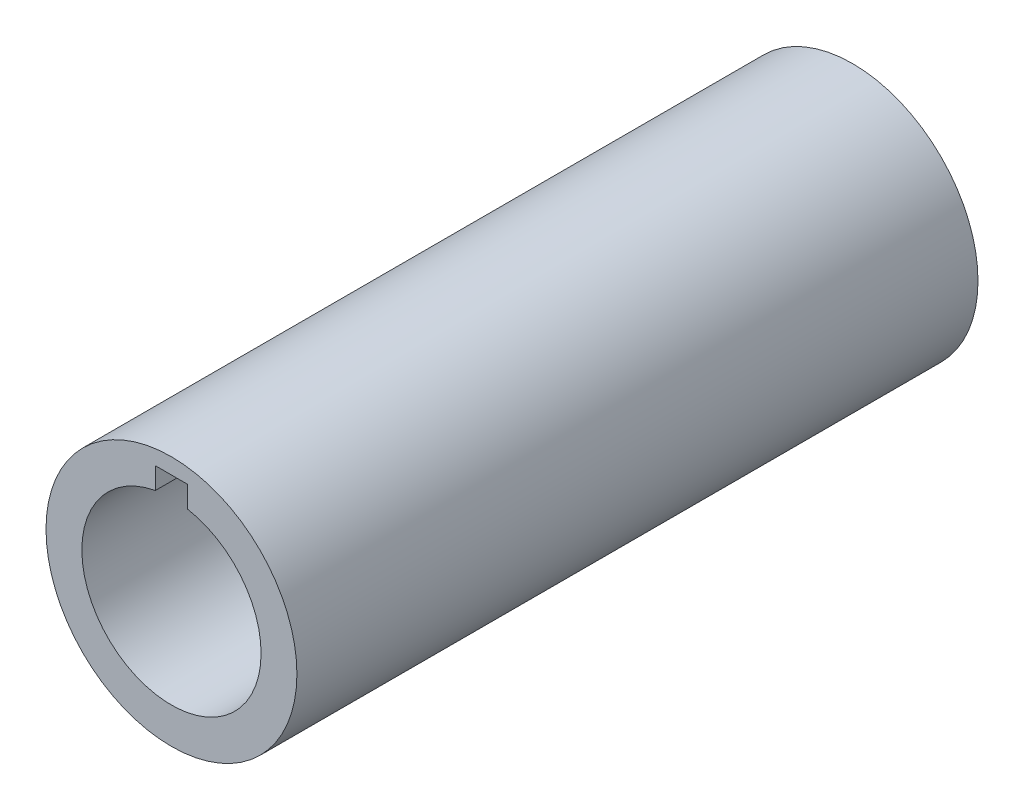
from build123d import *

# Parameters (mm, degrees)
CROQUIS1_R              = 3.5
SALIENTE_EXTRUIR1_DEPTH = 8
CROQUIS2_R              = 3.5
SALIENTE_EXTRUIR2_DEPTH = 1
CROQUIS3_R              = 3.5
SALIENTE_EXTRUIR3_DEPTH = 10


with BuildPart() as part:
    # Croquis1 → Saliente-Extruir1 (new body)
    with BuildSketch(Plane.XY):
        with Locations((-55.120752438, 48.948230875)):
            Circle(CROQUIS1_R)
        with BuildLine():
            Line((-55.570752438, 46.489064349), (-55.570752438, 47.089064349))
            Line((-55.570752438, 47.089064349), (-54.670752438, 47.089064349))
            Line((-54.670752438, 47.089064349), (-54.670752438, 46.489064349))
            ThreePointArc((-54.670752438, 46.489064349), (-55.120752438, 51.448230875), (-55.570752438, 46.489064349))
        make_face(mode=Mode.SUBTRACT)
    extrude(amount=SALIENTE_EXTRUIR1_DEPTH)

    # Croquis2 → Saliente-Extruir2 (add)
    with BuildSketch(Plane.XY.offset(8)):
        with Locations((-55.120752438, 48.948230875)):
            Circle(CROQUIS2_R)
    extrude(amount=SALIENTE_EXTRUIR2_DEPTH)

    # Croquis3 → Saliente-Extruir3 (add)
    with BuildSketch(Plane.XY.offset(9)):
        with Locations((-55.120752438, 48.948230875)):
            Circle(CROQUIS3_R)
        with BuildLine():
            Line((-55.570752438, 51.4073974), (-55.570752438, 52.0073974))
            Line((-55.570752438, 52.0073974), (-54.670752438, 52.0073974))
            Line((-54.670752438, 52.0073974), (-54.670752438, 51.4073974))
            ThreePointArc((-54.670752438, 51.4073974), (-55.120752438, 46.448230875), (-55.570752438, 51.4073974))
        make_face(mode=Mode.SUBTRACT)
    extrude(amount=SALIENTE_EXTRUIR3_DEPTH)


solid = part.part
